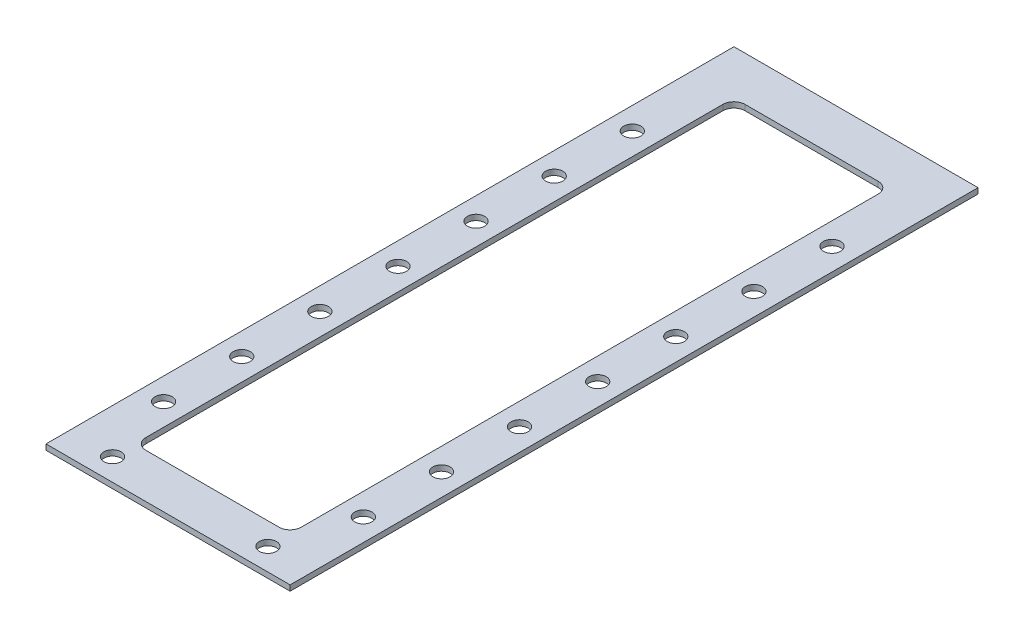
from build123d import *

# Parameters (mm, degrees)
BOSS_EXTRUDE1_DEPTH   = 1.5875
F_8_CLEARANCE_HOLE1_D = 4.9149


with BuildPart() as part:
    # Sketch1 → Boss-Extrude1 (new body)
    with BuildSketch(Plane(origin=(0, 0, 0), x_dir=(1, 0, 0), z_dir=(0, 1, 0))):
        with BuildLine():
            Line((0, 0), (69.85, 0))
            Line((69.85, 0), (69.85, 196.8246))
            ThreePointArc((69.85, 196.8246), (69.842560512, 196.842560512), (69.8246, 196.85))
            Line((69.8246, 196.85), (0.0254, 196.85))
            ThreePointArc((0.0254, 196.85), (0.007439488, 196.842560512), (0, 196.8246))
            Line((0, 196.8246), (0, 0))
        make_face()
        with BuildLine():
            Line((12.7, 15.875), (12.7, 180.975))
            ThreePointArc((12.7, 180.975), (13.62993597, 183.22006403), (15.875, 184.15))
            Line((15.875, 184.15), (53.975, 184.15))
            ThreePointArc((53.975, 184.15), (56.22006403, 183.22006403), (57.15, 180.975))
            Line((57.15, 180.975), (57.15, 15.875))
            ThreePointArc((57.15, 15.875), (56.22006403, 13.62993597), (53.975, 12.7))
            Line((53.975, 12.7), (15.875, 12.7))
            ThreePointArc((15.875, 12.7), (13.62993597, 13.62993597), (12.7, 15.875))
        make_face(mode=Mode.SUBTRACT)
    extrude(amount=BOSS_EXTRUDE1_DEPTH)

    # #8 Clearance Hole1 (through all)
    with Locations(Plane(origin=(0, 0, 0), x_dir=(-1, 0, 0), z_dir=(0, -1, 0))):
        with Locations((-6.35, 161.417), (-57.15, 6.35), (-12.7, 6.35), (-63.5, 27.305), (-6.35, 27.305), (-63.5, 139.065), (-63.5, 116.713), (-63.5, 94.361), (-63.5, 72.009), (-6.35, 49.657), (-6.35, 72.009), (-6.35, 94.361), (-6.35, 116.713), (-6.35, 139.065), (-63.5, 49.657), (-63.5, 161.417)):
            Hole(F_8_CLEARANCE_HOLE1_D / 2)


solid = part.part
